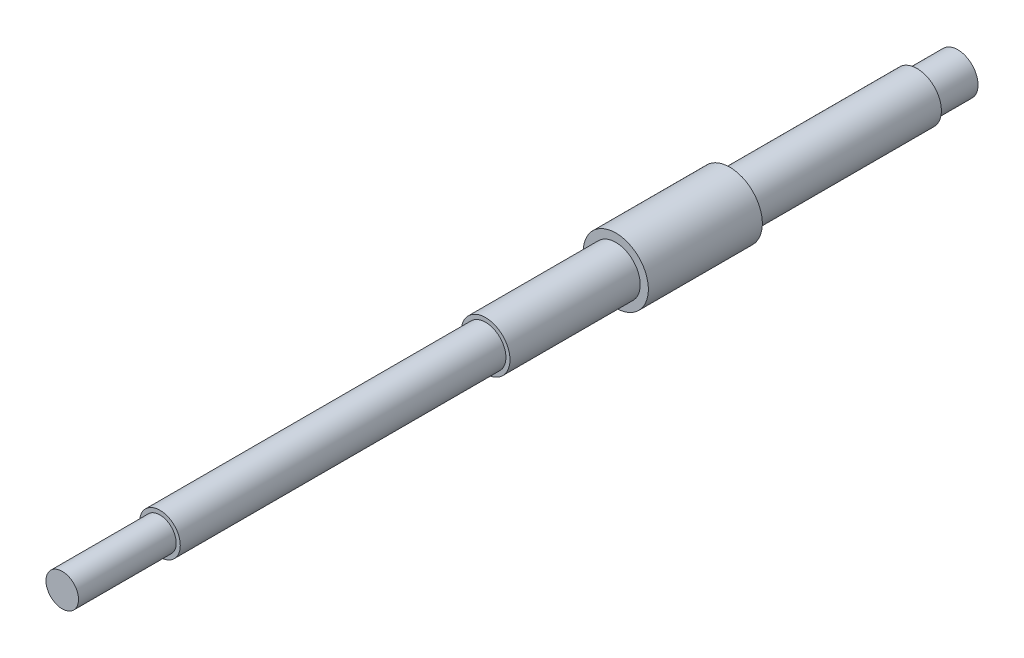
from build123d import *

# Parameters (mm, degrees)
SKETCH_1_R      = 3
EXTRUDE_1_DEPTH = 16
SKETCH_2_R      = 4
EXTRUDE_2_DEPTH = 14
EXTRUDE_START   = 23
SKETCH_3_R      = 3
EXTRUDE_3_DEPTH = 23
SKETCH_4_R      = 2.5
EXTRUDE_4_DEPTH = 40
SKETCH_7_R      = 2
EXTRUDE_5_DEPTH = 12
EXTRUDE_START_2 = 5
SKETCH_5_R      = 2.5
EXTRUDE_6_DEPTH = 5


with BuildPart() as part:
    # 草图1 → 凸台-拉伸1 (new body)
    with BuildSketch(Plane.XY):
        Circle(SKETCH_1_R)
    extrude(amount=EXTRUDE_1_DEPTH)

    # 草图2 → 凸台-拉伸2 (add)
    with BuildSketch(Plane(origin=(0, 0, 0), x_dir=(-1, 0, 0), z_dir=(0, 0, -1))):
        Circle(SKETCH_2_R)
    extrude(amount=EXTRUDE_2_DEPTH)

    # 草图3 → 凸台-拉伸3 (add)
    with BuildSketch(Plane(origin=(0, 0, -14), x_dir=(-1, 0, 0), z_dir=(0, 0, -1)).offset(EXTRUDE_START)):
        with Locations(Location((0, 0, 0), (0, 0, 180))):
            Circle(SKETCH_3_R)
    extrude(amount=-EXTRUDE_3_DEPTH)

    # 草图4 → 凸台-拉伸4 (add)
    with BuildSketch(Plane.XY.offset(16)):
        Circle(SKETCH_4_R)
    extrude(amount=EXTRUDE_4_DEPTH)

    # 草图7 → 凸台-拉伸5 (add)
    with BuildSketch(Plane.XY.offset(56)):
        Circle(SKETCH_7_R)
    extrude(amount=EXTRUDE_5_DEPTH)

    # 草图5 → 凸台-拉伸6 (add)
    with BuildSketch(Plane(origin=(0, 0, -37), x_dir=(-1, 0, 0), z_dir=(0, 0, -1)).offset(EXTRUDE_START_2)):
        with Locations(Location((0, 0, 0), (0, 0, 180))):
            Circle(SKETCH_5_R)
    extrude(amount=-EXTRUDE_6_DEPTH)


solid = part.part
